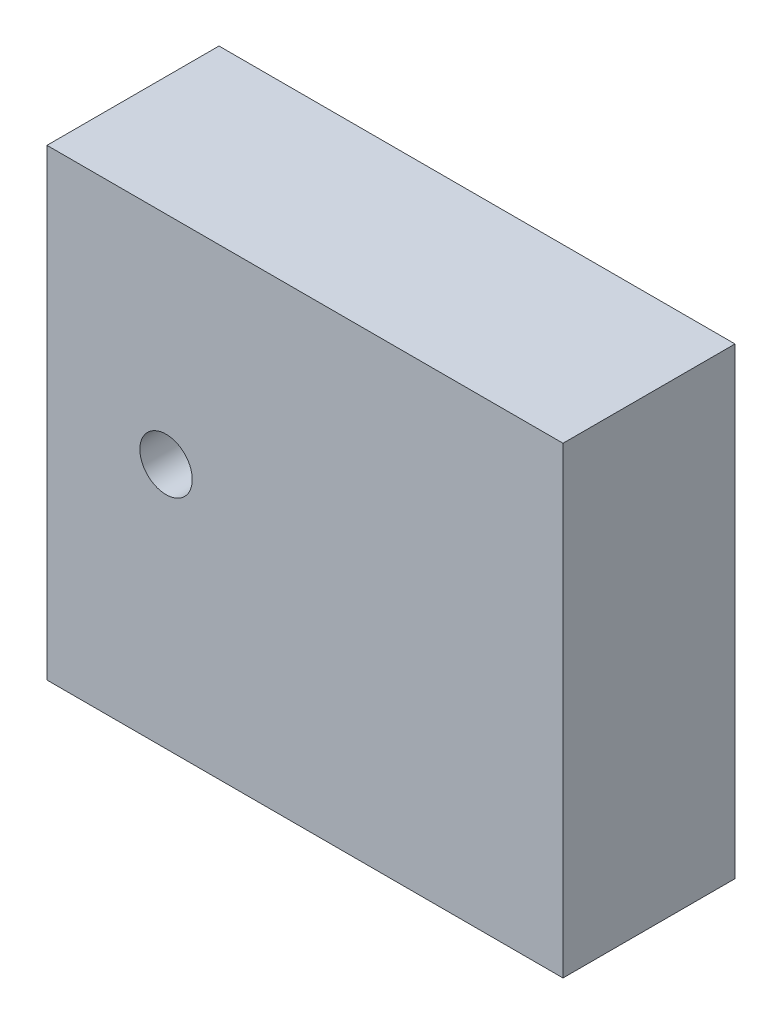
from build123d import *

# Parameters (mm, degrees)
IZIM1_W                     = 39
IZIM1_H                     = 35
IZIM1_R                     = 1.979898987
Y_KSEKLIK_EKSTR_ZYON1_DEPTH = 13


with BuildPart() as part:
    # Çizim1 → Yükseklik-Ekstrüzyon1 (new body)
    with BuildSketch(Plane.XY):
        Rectangle(IZIM1_W, IZIM1_H)
        with Locations(Location((-10.5, 1.114473684, 0), (0, 0, 180))):
            Circle(IZIM1_R, mode=Mode.SUBTRACT)
    extrude(amount=Y_KSEKLIK_EKSTR_ZYON1_DEPTH)


solid = part.part
